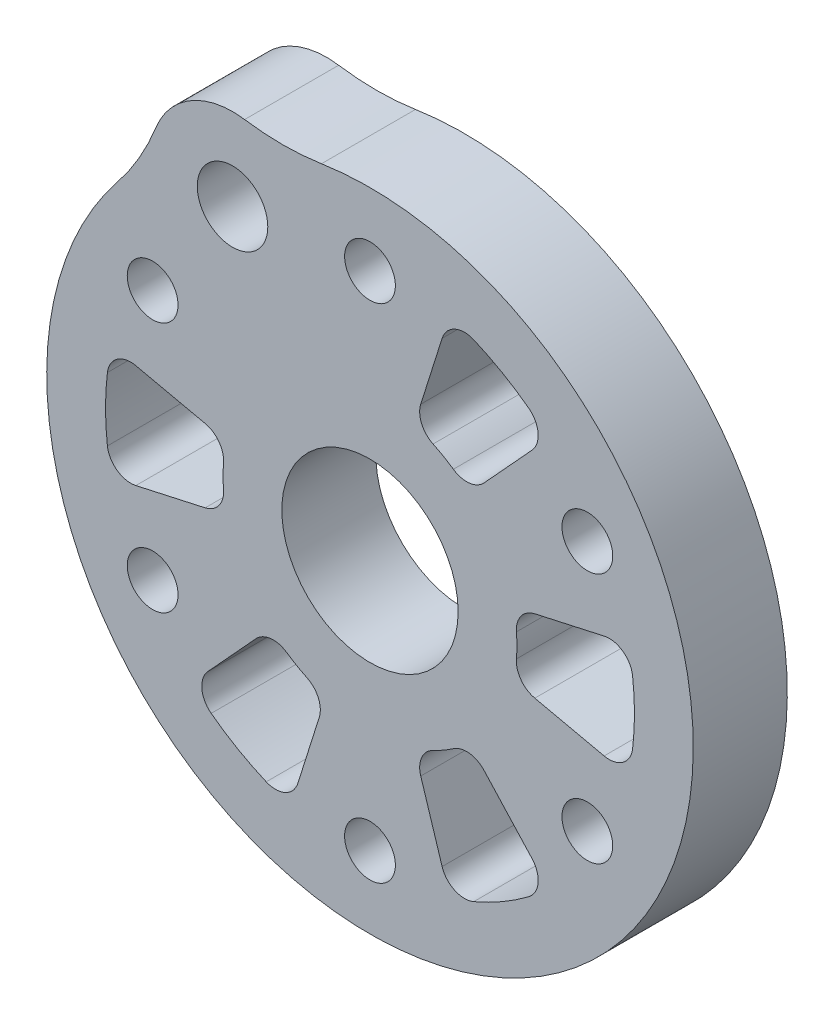
from build123d import *

# Parameters (mm, degrees)
ESQUISSE1_R                        = 3.75
ESQUISSE1_R_2                      = 1.5
BOSS_EXTRU_1_DEPTH                 = 4
ENL_V_MAT_EXTRU_1_REACH            = 21.853
ESQUISSE2_R                        = 1.08
R_P_TITION_CIRCULAIRE1_COUNT       = 6
CONG_1_R                           = 11
ENL_V_MAT_EXTRU_2_REACH            = 21.853
CONG_2_R                           = 1
R_P_TITION_CIRCULAIRE2_COUNT       = 5
R_P_TITION_CIRCULAIRE2_ANGLE       = 240
CONG_2_OF_R_P_TITION_CIRCULAIRE2_R = 1


with BuildPart() as part:
    # Esquisse1 → Boss.-Extru.1 (new body)
    with BuildSketch(Plane.XY):
        with BuildLine():
            ThreePointArc((-9.34643428, 10.084972298), (6.875, -11.907849302), (-4.060625067, 13.13673567))
            ThreePointArc((-4.060625067, 13.13673567), (-7.596683666, 13.157842079), (-9.34643428, 10.084972298))
        make_face()
        Circle(ESQUISSE1_R, mode=Mode.SUBTRACT)
        with Locations((-5.846683666, 10.126753165)):
            Circle(ESQUISSE1_R_2, mode=Mode.SUBTRACT)
    extrude(amount=BOSS_EXTRU_1_DEPTH)

    # Esquisse2 → Enlèv. mat.-Extru.1 (cut, up to next)
    with BuildSketch(Plane.XY.offset(4), mode=Mode.PRIVATE) as enl_v_mat_extru_1_sk1:
        with Locations((0, 10.675)):
            Circle(ESQUISSE2_R)
    enl_v_mat_extru_1_tool1 = extrude(enl_v_mat_extru_1_sk1.sketch, amount=-ENL_V_MAT_EXTRU_1_REACH, mode=Mode.PRIVATE) & part.part
    enl_v_mat_extru_1 = enl_v_mat_extru_1_tool1.solids().sort_by_distance((0, 10.675, 4))[0]
    add(enl_v_mat_extru_1, mode=Mode.SUBTRACT)

    # Répétition circulaire1: Enlèv. mat.-Extru.1 ×6 about axis
    r_p_tition_circulaire1_axis = Axis((0, 0, 0), (0, 0, 1))
    for i in range(1, R_P_TITION_CIRCULAIRE1_COUNT):
        add(enl_v_mat_extru_1.rotate(r_p_tition_circulaire1_axis, i * 360 / R_P_TITION_CIRCULAIRE1_COUNT), mode=Mode.SUBTRACT)

    # Congé1
    cong_1_edges = [part.edges().sort_by_distance(p)[0] for p in [
        (-4.060625067, 13.13673567, 2),
        (-9.34643428, 10.084972298, 2),
    ]]
    fillet(cong_1_edges, radius=CONG_1_R)

    # Esquisse3 → Enlèv. mat.-Extru.2 (cut, up to next)
    with BuildSketch(Plane(origin=(0, 0, 0), x_dir=(-1, 0, 0), z_dir=(0, 0, -1)), mode=Mode.PRIVATE) as enl_v_mat_extru_2_sk1:
        with BuildLine():
            Line((-3.382940244, 10.729315696), (-1.879411247, 5.960730942))
            ThreePointArc((-1.879411247, 5.960730942), (-3.125, 5.412658774), (-4.222438798, 4.607983355))
            Line((-4.222438798, 4.607983355), (-7.600389836, 8.294370039))
            ThreePointArc((-7.600389836, 8.294370039), (-5.625, 9.742785793), (-3.382940244, 10.729315696))
        make_face()
    enl_v_mat_extru_2_tool1 = extrude(enl_v_mat_extru_2_sk1.sketch, amount=-ENL_V_MAT_EXTRU_2_REACH, mode=Mode.PRIVATE) & part.part
    enl_v_mat_extru_2 = enl_v_mat_extru_2_tool1.solids().sort_by_distance((4.458482, 7.722318, 0))[0]
    add(enl_v_mat_extru_2, mode=Mode.SUBTRACT)

    # Congé2
    cong_2_edges = [part.edges().sort_by_distance(p)[0] for p in [
        (7.600389836, 8.294370039, 2),
        (3.382940244, 10.729315696, 2),
        (1.879411247, 5.960730942, 2),
        (4.222438798, 4.607983355, 2),
    ]]
    fillet(cong_2_edges, radius=CONG_2_R)

    # Répétition circulaire2: Enlèv. mat.-Extru.2 ×5 about axis
    r_p_tition_circulaire2_axis = Axis((0, 0, 0), (0, 0, -1))
    for i in range(1, R_P_TITION_CIRCULAIRE2_COUNT):
        add(enl_v_mat_extru_2.rotate(r_p_tition_circulaire2_axis, i * R_P_TITION_CIRCULAIRE2_ANGLE / (R_P_TITION_CIRCULAIRE2_COUNT - 1)), mode=Mode.SUBTRACT)

    # Congé2 of Répétition circulaire2
    cong_2_of_r_p_tition_circulaire2_edges = [part.edges().sort_by_distance(p)[0] for p in [
        (10.98333008, -2.434945657, 2),
        (10.98333008, 2.434945657, 2),
        (6.101850044, 1.352747587, 2),
        (6.101850044, -1.352747587, 2),
        (3.382940244, -10.729315696, 2),
        (7.600389836, -8.294370039, 2),
        (4.222438798, -4.607983355, 2),
        (1.879411247, -5.960730942, 2),
        (-7.600389836, -8.294370039, 2),
        (-3.382940244, -10.729315696, 2),
        (-1.879411247, -5.960730942, 2),
        (-4.222438798, -4.607983355, 2),
        (-10.98333008, 2.434945657, 2),
        (-10.98333008, -2.434945657, 2),
        (-6.101850044, -1.352747587, 2),
        (-6.101850044, 1.352747587, 2),
    ]]
    fillet(cong_2_of_r_p_tition_circulaire2_edges, radius=CONG_2_OF_R_P_TITION_CIRCULAIRE2_R)


solid = part.part
